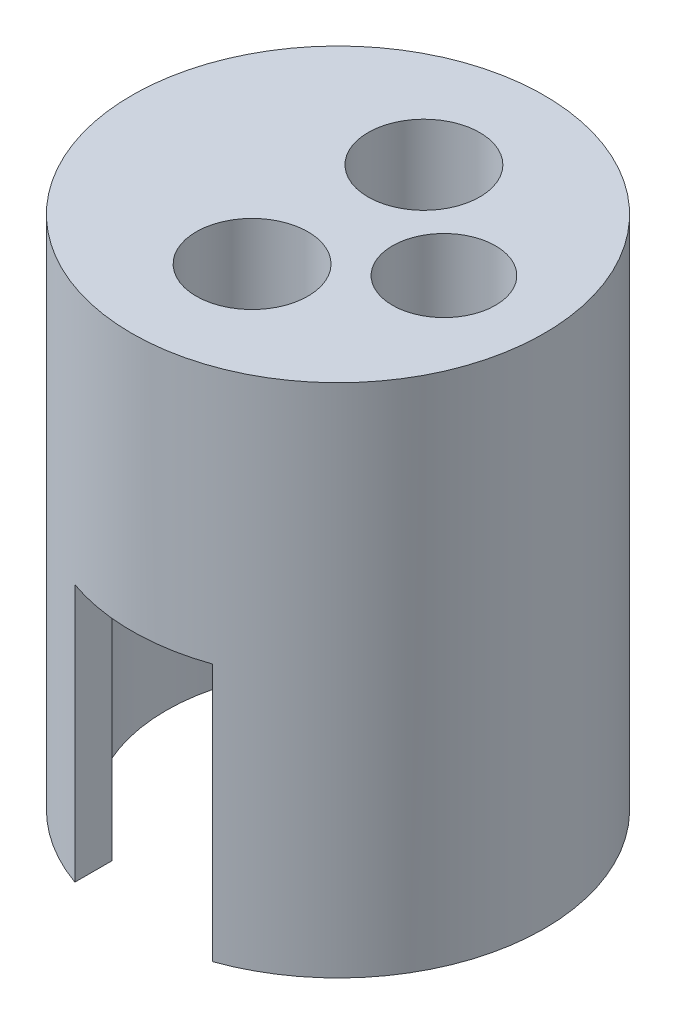
from build123d import *
from build123d.topology import SkipClean

# Parameters (mm, degrees)
SKETCH1_R           = 1.25
BOSS_EXTRUDE1_DEPTH = 15
BOSS_EXTRUDE2_START = 15
BOSS_EXTRUDE2_DEPTH = 15
SKETCH4_R           = 2.25
CUT_EXTRUDE2_DEPTH  = 2.5
SKETCH5_R           = 2.25
CUT_EXTRUDE3_DEPTH  = 2.5
SKETCH6_R           = 3.7
CUT_EXTRUDE4_DEPTH  = 2
SKETCH12_R          = 3.25
CUT_EXTRUDE5_DEPTH  = 7
SKETCH13_R          = 3.25
CUT_EXTRUDE6_DEPTH  = 7


with BuildPart() as part:
    # Sketch1 → Boss-Extrude1 (new body)
    # profile 1 of 3: a face of its own
    with BuildSketch(Plane(origin=(0, 0, 0), x_dir=(1, 0, 0), z_dir=(0, 1, 0))):
        with BuildLine():
            Line((13.265157172, 12.897160092), (13.265157172, 10.748602983))
            ThreePointArc((13.265157172, 10.748602983), (7.265157172, 1.583451593), (13.265157172, -7.581699797))
            Line((13.265157172, -7.581699797), (13.265157172, -9.730256906))
            ThreePointArc((13.265157172, -9.730256906), (17.265157172, -10.416548407), (21.265157172, -9.730256906))
            Line((21.265157172, -9.730256906), (21.265157172, -7.581699797))
            ThreePointArc((21.265157172, -7.581699797), (27.265157172, 1.583451593), (21.265157172, 10.748602983))
            Line((21.265157172, 10.748602983), (21.265157172, 12.897160092))
            ThreePointArc((21.265157172, 12.897160092), (17.265157172, 13.583451593), (13.265157172, 12.897160092))
        make_face()
        with Locations(Location((17.265157172, -3.416548407, 0), (0, 0, 270))):
            Circle(SKETCH1_R, mode=Mode.SUBTRACT)
        with Locations(Location((17.265157172, 6.583451593, 0), (0, 0, 270))):
            Circle(SKETCH1_R, mode=Mode.SUBTRACT)
        with BuildLine():
            ThreePointArc((26.432063002, 1.583451593), (24.549936544, -1.20049502), (21.265157172, -0.491281913))
            ThreePointArc((21.265157172, -0.491281913), (20.432063002, 1.583451593), (21.265157172, 3.6581851))
            ThreePointArc((21.265157172, 3.6581851), (24.549936544, 4.367398207), (26.432063002, 1.583451593))
        make_face(mode=Mode.SUBTRACT)
    # profile 2 of 3: a face of its own
    with BuildSketch(Plane(origin=(0, 0, 0), x_dir=(1, 0, 0), z_dir=(0, 1, 0))):
        with BuildLine():
            ThreePointArc((13.265157172, -7.581699797), (7.265157172, 1.583451593), (13.265157172, 10.748602983))
            Line((13.265157172, 10.748602983), (13.265157172, 12.897160092))
            ThreePointArc((13.265157172, 12.897160092), (5.265157172, 1.583451593), (13.265157172, -9.730256906))
            Line((13.265157172, -9.730256906), (13.265157172, -7.581699797))
        make_face()
    # profile 3 of 3: a face of its own
    with BuildSketch(Plane(origin=(0, 0, 0), x_dir=(1, 0, 0), z_dir=(0, 1, 0))):
        with BuildLine():
            ThreePointArc((29.265157172, 1.583451593), (27.063116143, 8.511654824), (21.265157172, 12.897160092))
            Line((21.265157172, 12.897160092), (21.265157172, 10.748602983))
            ThreePointArc((21.265157172, 10.748602983), (27.265157172, 1.583451593), (21.265157172, -7.581699797))
            Line((21.265157172, -7.581699797), (21.265157172, -9.730256906))
            ThreePointArc((21.265157172, -9.730256906), (27.063116143, -5.344751637), (29.265157172, 1.583451593))
        make_face()
    extrude(amount=BOSS_EXTRUDE1_DEPTH)

    # Sketch3 → Boss-Extrude2 (add)
    with SkipClean():  # the faces are left unmerged after this step: merging them gives an invalid solid
        with BuildSketch(Plane.XZ.offset(BOSS_EXTRUDE2_START)):
            with BuildLine():
                Line((13.265157172, -12.897160092), (13.265157172, -10.748602983))
                ThreePointArc((13.265157172, -10.748602983), (7.265157172, -1.583451593), (13.265157172, 7.581699797))
                Line((13.265157172, 7.581699797), (13.265157172, 9.730256906))
                ThreePointArc((13.265157172, 9.730256906), (5.265157172, -1.583451593), (13.265157172, -12.897160092))
            make_face()
            with BuildLine():
                Line((21.265157172, -10.748602983), (21.265157172, -12.897160092))
                ThreePointArc((21.265157172, -12.897160092), (27.063116143, -8.511654824), (29.265157172, -1.583451593))
                ThreePointArc((29.265157172, -1.583451593), (27.063116143, 5.344751637), (21.265157172, 9.730256906))
                Line((21.265157172, 9.730256906), (21.265157172, 7.581699797))
                ThreePointArc((21.265157172, 7.581699797), (27.265157172, -1.583451593), (21.265157172, -10.748602983))
            make_face()
        extrude(amount=-BOSS_EXTRUDE2_DEPTH)

    # Sketch4 → Cut-Extrude2 (cut)
    with SkipClean():  # the faces are left unmerged after this step: merging them gives an invalid solid
        with BuildSketch(Plane.XZ):
            with Locations(Location((17.265157172, -6.583451593, 0), (0, 0, 270))):
                Circle(SKETCH4_R)
        extrude(amount=-CUT_EXTRUDE2_DEPTH, mode=Mode.SUBTRACT)

    # Sketch5 → Cut-Extrude3 (cut)
    with SkipClean():  # the faces are left unmerged after this step: merging them gives an invalid solid
        with BuildSketch(Plane.XZ):
            with Locations(Location((17.265157172, 3.416548407, 0), (0, 0, 270))):
                Circle(SKETCH5_R)
        extrude(amount=-CUT_EXTRUDE3_DEPTH, mode=Mode.SUBTRACT)

    # Sketch6 → Cut-Extrude4 (cut)
    with SkipClean():  # the faces are left unmerged after this step: merging them gives an invalid solid
        with BuildSketch(Plane.XZ):
            with Locations(Location((23.432063002, -1.583451593, 0), (0, 0, 270))):
                Circle(SKETCH6_R)
        extrude(amount=-CUT_EXTRUDE4_DEPTH, mode=Mode.SUBTRACT)

    # Sketch12 → Cut-Extrude5 (cut)
    with SkipClean():  # the faces are left unmerged after this step: merging them gives an invalid solid
        with BuildSketch(Plane(origin=(0, 15, 0), x_dir=(1, 0, 0), z_dir=(0, 1, 0))):
            with Locations(Location((17.265157172, 6.583451593, 0), (0, 0, 270))):
                Circle(SKETCH12_R)
        extrude(amount=-CUT_EXTRUDE5_DEPTH, mode=Mode.SUBTRACT)

    # Sketch13 → Cut-Extrude6 (cut)
    with SkipClean():  # the faces are left unmerged after this step: merging them gives an invalid solid
        with BuildSketch(Plane(origin=(0, 15, 0), x_dir=(1, 0, 0), z_dir=(0, 1, 0))):
            with Locations(Location((17.265157172, -3.416548407, 0), (0, 0, 270))):
                Circle(SKETCH13_R)
        extrude(amount=-CUT_EXTRUDE6_DEPTH, mode=Mode.SUBTRACT)


solid = part.part
